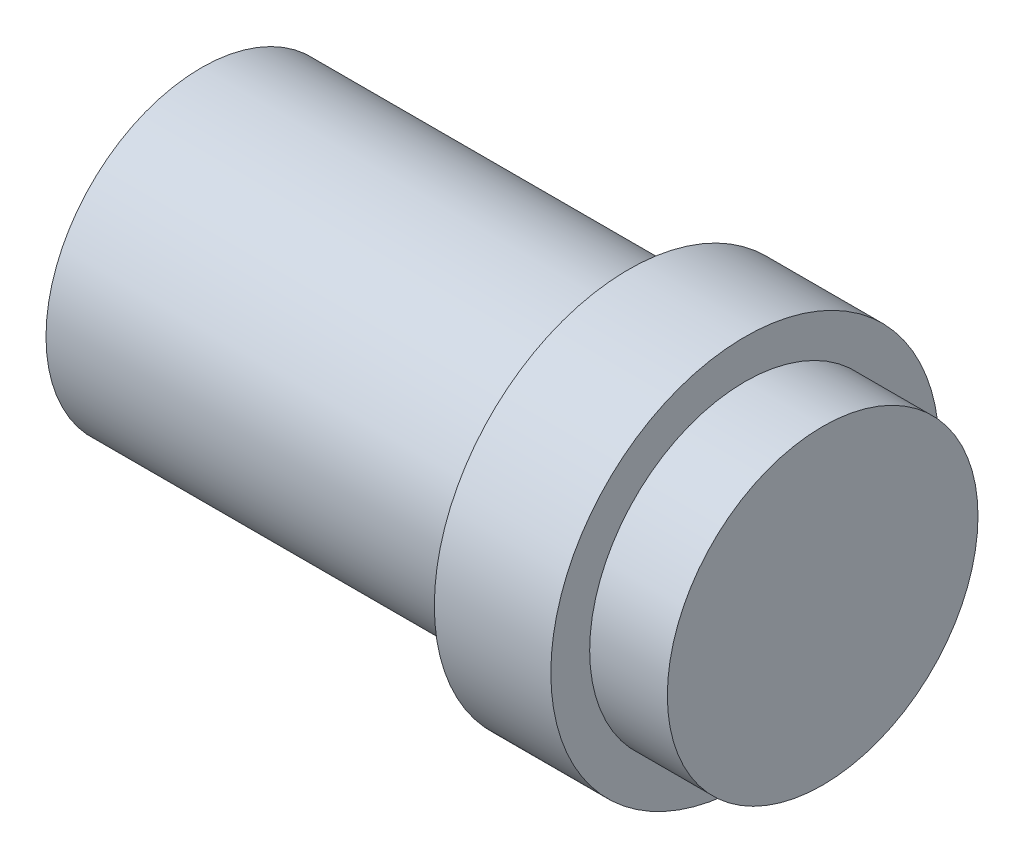
from build123d import *


with BuildPart() as part:
    # 草图1 → 旋转1 (revolve)
    with BuildSketch(Plane.XY, mode=Mode.PRIVATE) as revolve_1_sk:
        Polygon((-25, 0), (-25, 8), (-3, 8), (-3, 10), (3, 10), (3, 8), (7, 8), (7, 0), align=None)
    revolve(revolve_1_sk.sketch.rotate(Axis((-84.795984063, 0, 0), (1, 0, 0)), 90), axis=Axis((-84.795984063, 0, 0), (1, 0, 0)))


solid = part.part
